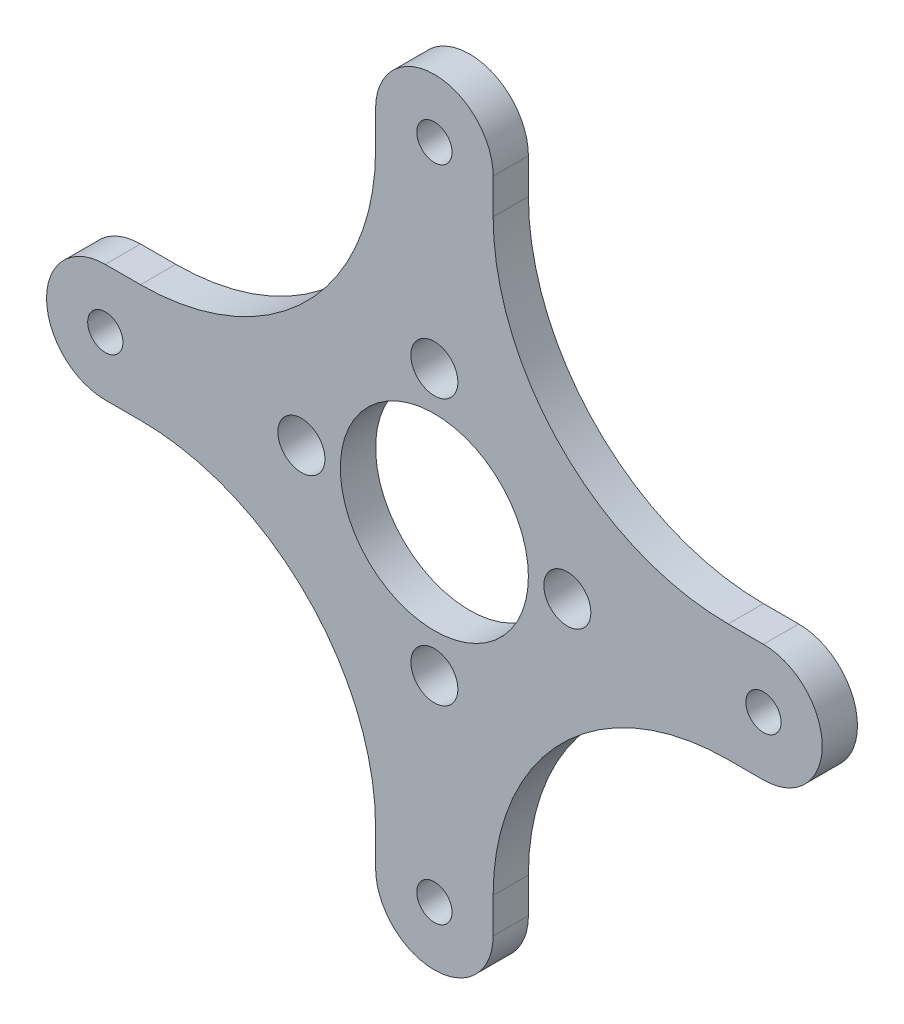
from build123d import *

# Parameters (mm, degrees)
SKETCH1_R           = 1.5
SKETCH1_R_2         = 2
SKETCH1_R_3         = 8
BOSS_EXTRUDE1_DEPTH = 3


with BuildPart() as part:
    # Sketch1 → Boss-Extrude1 (new body)
    with BuildSketch(Plane.XY):
        with BuildLine():
            Line((5, 28), (5, 25))
            ThreePointArc((5, 25), (10.857864376, 10.857864376), (25, 5))
            Line((25, 5), (28, 5))
            ThreePointArc((28, 5), (33, 0), (28, -5))
            Line((28, -5), (25, -5))
            ThreePointArc((25, -5), (10.857864376, -10.857864376), (5, -25))
            Line((5, -25), (5, -28))
            ThreePointArc((5, -28), (0, -33), (-5, -28))
            Line((-5, -28), (-5, -25))
            ThreePointArc((-5, -25), (-10.857864376, -10.857864376), (-25, -5))
            Line((-25, -5), (-28, -5))
            ThreePointArc((-28, -5), (-33, 0), (-28, 5))
            Line((-28, 5), (-25, 5))
            ThreePointArc((-25, 5), (-10.857864376, 10.857864376), (-5, 25))
            Line((-5, 25), (-5, 28))
            ThreePointArc((-5, 28), (0, 33), (5, 28))
        make_face()
        with Locations((0, 28)):
            Circle(SKETCH1_R, mode=Mode.SUBTRACT)
        with Locations((28, 0)):
            Circle(SKETCH1_R, mode=Mode.SUBTRACT)
        with Locations((0, -28)):
            Circle(SKETCH1_R, mode=Mode.SUBTRACT)
        with Locations((-28, 0)):
            Circle(SKETCH1_R, mode=Mode.SUBTRACT)
        with Locations((0, -11.313708499)):
            Circle(SKETCH1_R_2, mode=Mode.SUBTRACT)
        with Locations((-11.313708499, 0)):
            Circle(SKETCH1_R_2, mode=Mode.SUBTRACT)
        with Locations((0, 11.313708499)):
            Circle(SKETCH1_R_2, mode=Mode.SUBTRACT)
        with Locations((11.313708499, 0)):
            Circle(SKETCH1_R_2, mode=Mode.SUBTRACT)
        Circle(SKETCH1_R_3, mode=Mode.SUBTRACT)
    extrude(amount=BOSS_EXTRUDE1_DEPTH)


solid = part.part
